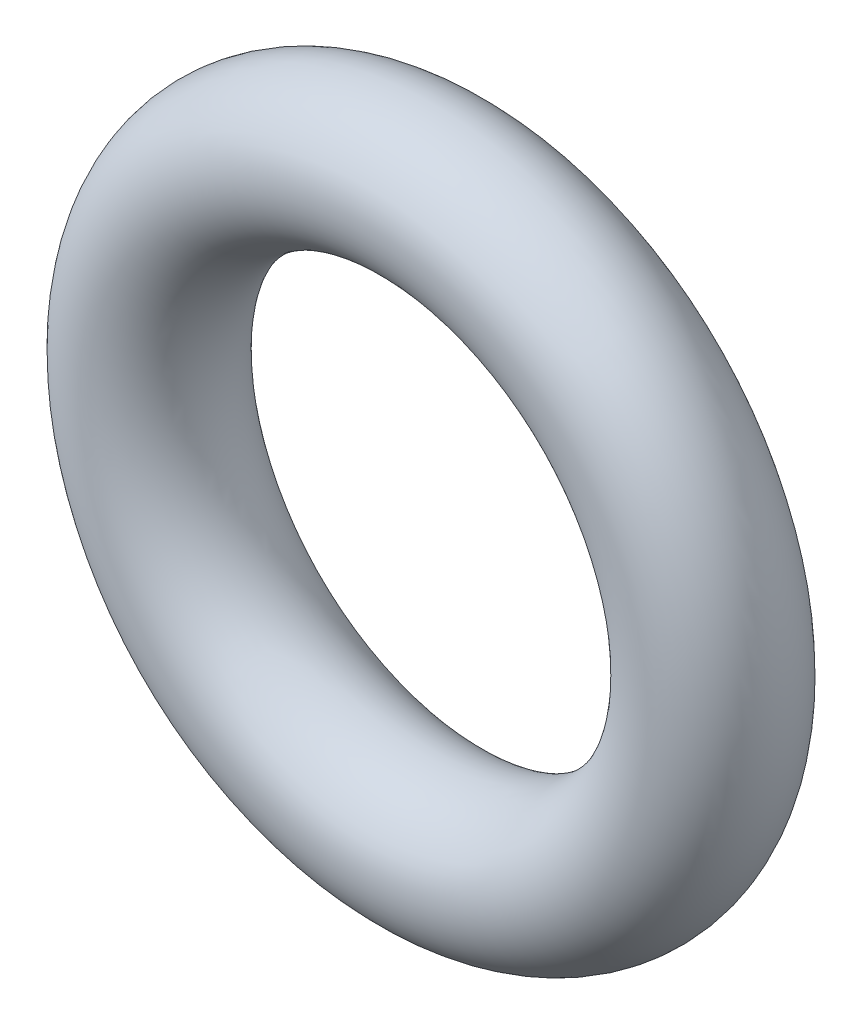
from build123d import *

# Parameters (mm, degrees)
SKETCH1_R = 1.3081


with BuildPart() as part:
    # Sketch1 → Revolve1 (revolve)
    with BuildSketch(Plane(origin=(0, 0, 0), x_dir=(0, -1, 0), z_dir=(1, 0, 0)), mode=Mode.PRIVATE) as revolve1_sk:
        with Locations((5.1054, 0)):
            Circle(SKETCH1_R)
    revolve(revolve1_sk.sketch.rotate(Axis((0, 0, 1.3081), (0, 0, -1)), 270), axis=Axis((0, 0, 1.3081), (0, 0, -1)))


solid = part.part
